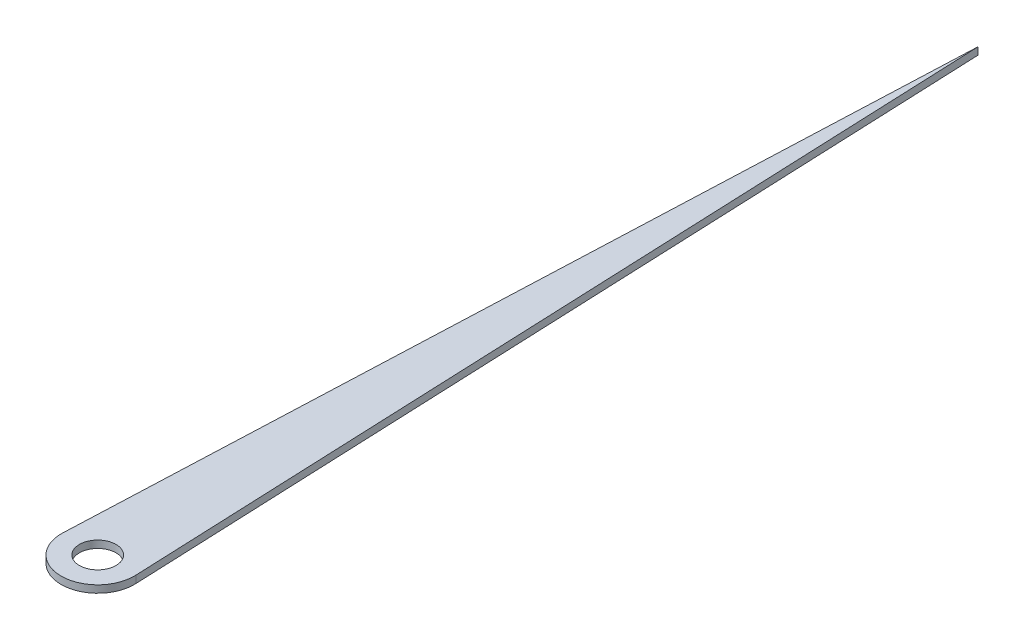
from build123d import *

# Parameters (mm, degrees)
SKETCH2_R           = 0.635
BOSS_EXTRUDE2_DEPTH = 0.254


with BuildPart() as part:
    # Sketch2 → Boss-Extrude2 (new body)
    with BuildSketch(Plane(origin=(0, 0, 0), x_dir=(1, 0, 0), z_dir=(0, 1, 0))):
        with BuildLine():
            ThreePointArc((0.102880591, 0.162190576), (1.371782732, -1.160604852), (2.640684873, 0.162190576))
            Line((2.640684873, 0.162190576), (1.371782732, 30.659388884))
            Line((1.371782732, 30.659388884), (0.102880591, 0.162190576))
        make_face()
        with Locations(Location((1.371782732, 0.109395148, 0), (0, 0, 270))):
            Circle(SKETCH2_R, mode=Mode.SUBTRACT)
    extrude(amount=BOSS_EXTRUDE2_DEPTH)


solid = part.part
